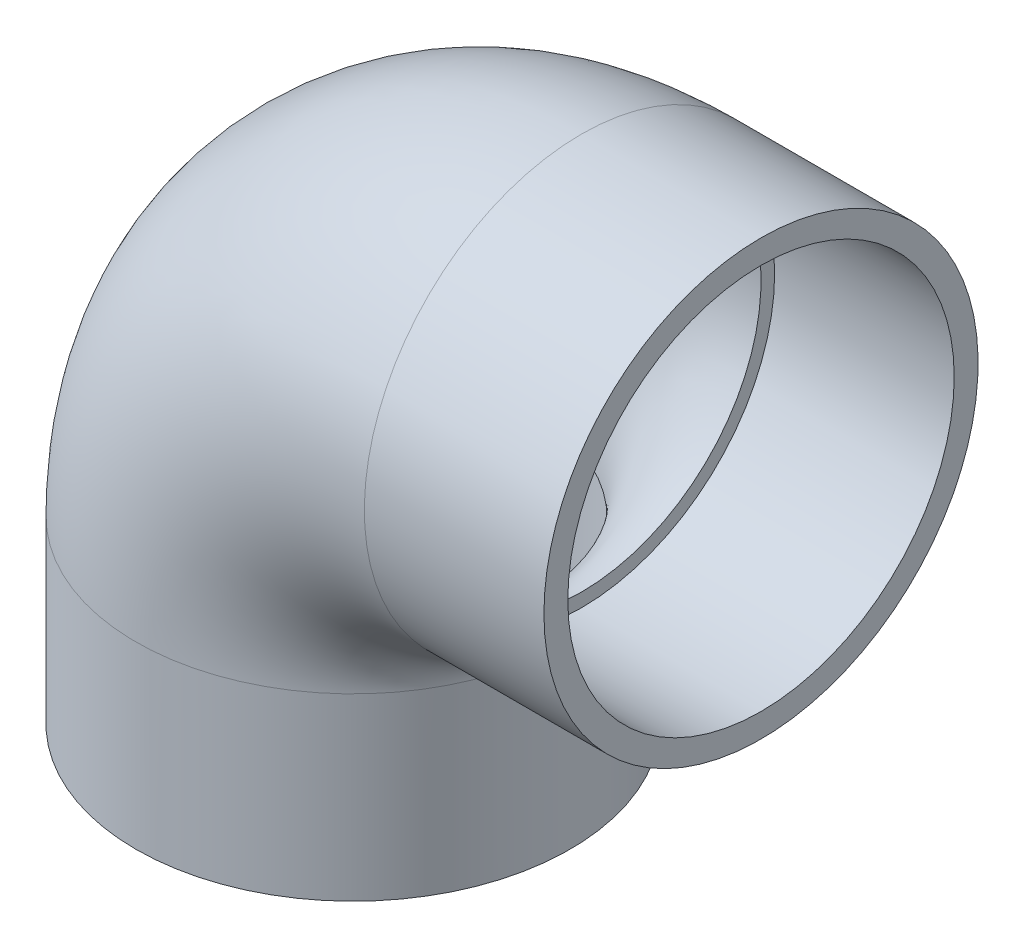
from build123d import *

# Parameters (mm, degrees)
CROQUIS4_R            = 95.5
CROQUIS4_R_2          = 79
CORTAR_EXTRUIR1_START = -79
CROQUIS6_R            = 85
CROQUIS6_R_2          = 79
CORTAR_EXTRUIR1_DEPTH = 79
CROQUIS7_R            = 85
CROQUIS7_R_2          = 79
CORTAR_EXTRUIR2_DEPTH = 79


with BuildPart() as part:
    # Barrer5: sweep along a path in Croquis3
    with BuildLine(Plane.XY) as barrer5_path:
        Line((0, 0), (0, 79))
        ThreePointArc((0, 79), (29.435768491, 150.064231509), (100.5, 179.5))
        Line((100.5, 179.5), (179.5, 179.5))
    # Croquis4 → Barrer5 (sweep)
    with BuildSketch(Plane(origin=(0, 0, 0), x_dir=(1, 0, 0), z_dir=(0, 1, 0))):
        Circle(CROQUIS4_R)
        Circle(CROQUIS4_R_2, mode=Mode.SUBTRACT)
    sweep(path=barrer5_path.line)

    # Croquis6 → Cortar-Extruir1 (cut)
    with BuildSketch(Plane.XZ.offset(CORTAR_EXTRUIR1_START)):
        with Locations(Location((0, 0, 0), (0, 0, 270))):
            Circle(CROQUIS6_R)
        Circle(CROQUIS6_R_2, mode=Mode.SUBTRACT)
    extrude(amount=CORTAR_EXTRUIR1_DEPTH, mode=Mode.SUBTRACT)

    # Croquis7 → Cortar-Extruir2 (cut)
    with BuildSketch(Plane(origin=(179.5, 0, 0), x_dir=(0, 0, -1), z_dir=(1, 0, 0))):
        with Locations(Location((0, 179.5, 0), (0, 0, 90))):
            Circle(CROQUIS7_R)
        with Locations((0, 179.5)):
            Circle(CROQUIS7_R_2, mode=Mode.SUBTRACT)
    extrude(amount=-CORTAR_EXTRUIR2_DEPTH, mode=Mode.SUBTRACT)


solid = part.part
